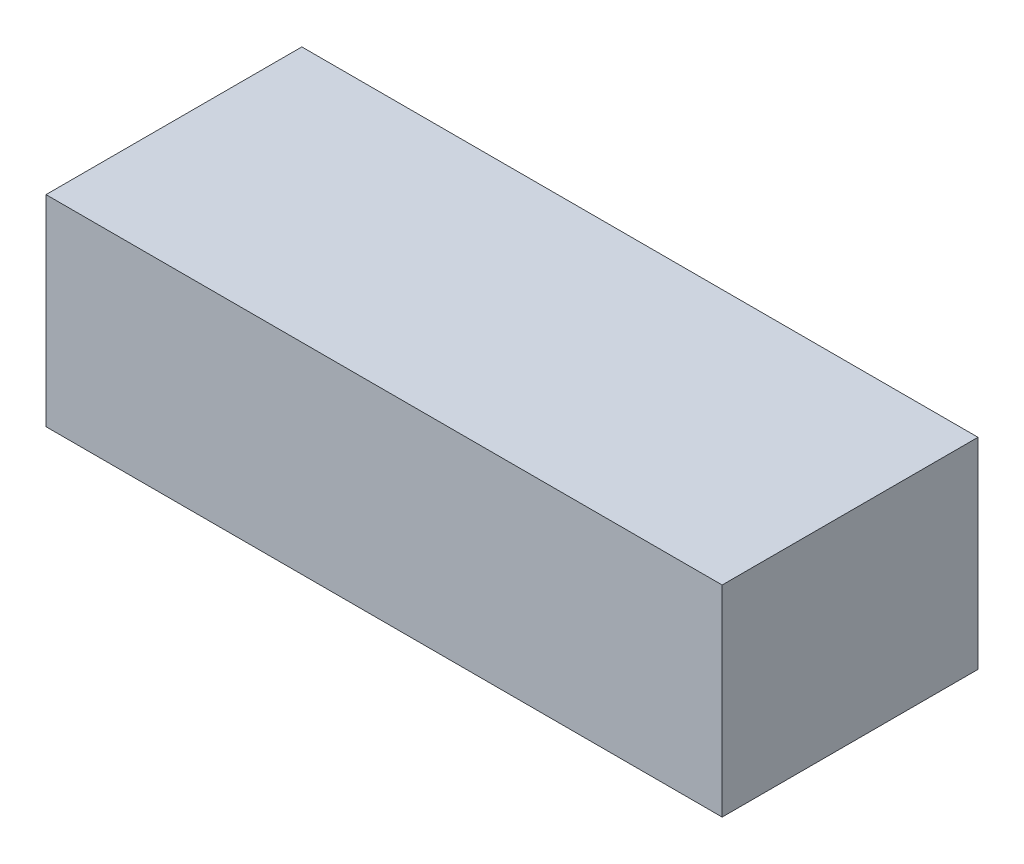
from build123d import *

# Parameters (mm, degrees)
SKETCH_1_W      = 37
SKETCH_1_H      = 14
EXTRUDE_1_DEPTH = 11


with BuildPart() as part:
    # 草图1 → 凸台-拉伸1 (new body)
    with BuildSketch(Plane(origin=(0, 0, 0), x_dir=(1, 0, 0), z_dir=(0, 1, 0))):
        with Locations((-0.284615385, 0.4)):
            Rectangle(SKETCH_1_W, SKETCH_1_H)
    extrude(amount=EXTRUDE_1_DEPTH)


solid = part.part
